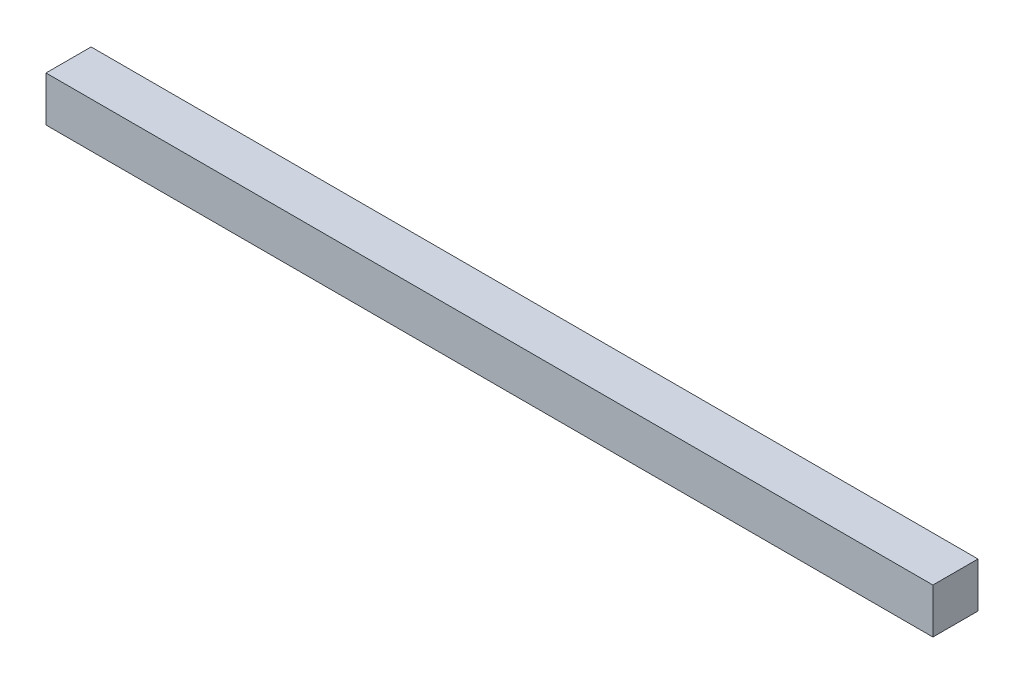
from build123d import *

# Parameters (mm, degrees)
SKETCH1_W           = 590
SKETCH1_H           = 30
BOSS_EXTRUDE1_DEPTH = 30


with BuildPart() as part:
    # Sketch1 → Boss-Extrude1 (new body)
    with BuildSketch(Plane(origin=(0, 0, 0), x_dir=(1, 0, 0), z_dir=(0, 1, 0))):
        with Locations((295, 15)):
            Rectangle(SKETCH1_W, SKETCH1_H)
    extrude(amount=BOSS_EXTRUDE1_DEPTH)


solid = part.part
